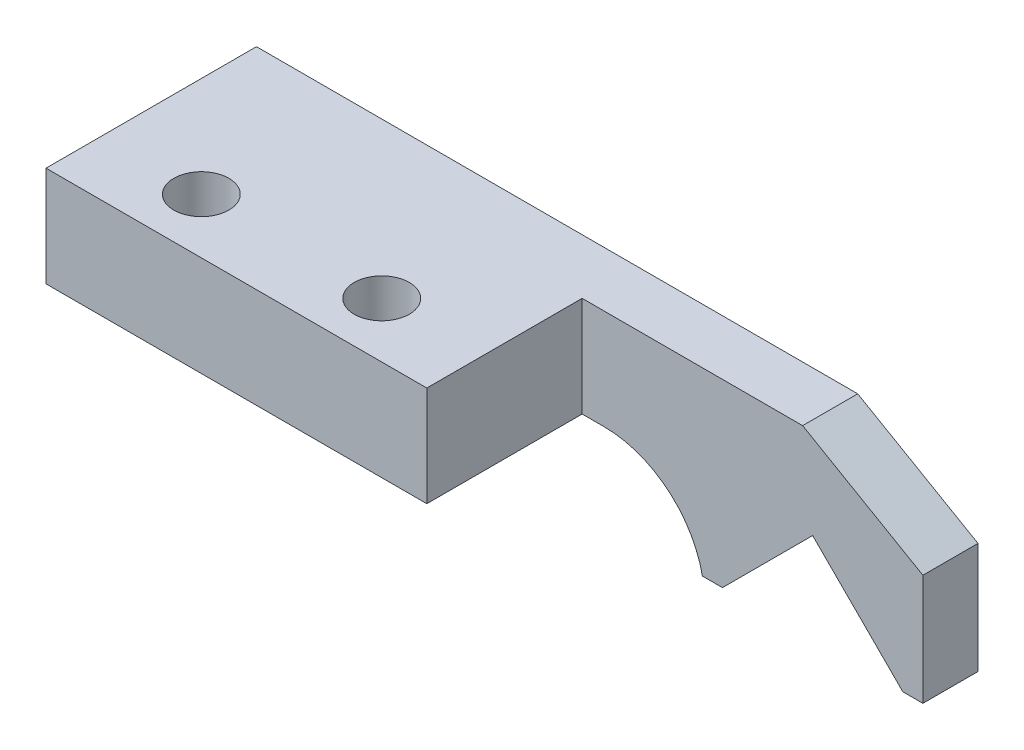
from build123d import *

# Parameters (mm, degrees)
BASE_EXTRUSION_DEPTH    = 21
ESQUISSE2_W             = 56.002380091
ESQUISSE2_H             = 20.539256902
ENL_V_MAT_EXTRU_1_DEPTH = 78.129760793
ESQUISSE3_R             = 5
ENL_V_MAT_EXTRU_2_DEPTH = 6
ESQUISSE4_R             = 2.75
ENL_V_MAT_EXTRU_3_DEPTH = 6


with BuildPart() as part:
    # Esquisse1 → Base-Extrusion (new body)
    with BuildSketch(Plane.XY):
        with BuildLine():
            Line((0, 0), (0, 10))
            Line((0, 10), (60, 10))
            Line((60, 10), (72, 3.07179677))
            Line((72, 3.07179677), (72, -8))
            Line((72, -8), (70, -8))
            Line((70, -8), (61, 1))
            Line((61, 1), (52, -8))
            Line((52, -8), (50, -8))
            ThreePointArc((50, -8), (46.526596349, -2.254033308), (40.202041029, 0))
            Line((40.202041029, 0), (0, 0))
        make_face()
    extrude(amount=BASE_EXTRUSION_DEPTH)

    # Esquisse2 → Enlèv. mat.-Extru.1 (cut, through all)
    with BuildSketch(Plane(origin=(0, 10, 0), x_dir=(-1, 0, 0), z_dir=(0, 1, 0))):
        with Locations((-66.001190046, 15.769628451)):
            Rectangle(ESQUISSE2_W, ESQUISSE2_H)
    extrude(amount=-ENL_V_MAT_EXTRU_1_DEPTH, mode=Mode.SUBTRACT)

    # Esquisse3 → Enlèv. mat.-Extru.2 (cut)
    with BuildSketch(Plane.XZ):
        with Locations(Location((28, 15.5, 0), (0, 0, 270))):
            Circle(ESQUISSE3_R)
        with Locations(Location((10, 15.5, 0), (0, 0, 270))):
            Circle(ESQUISSE3_R)
    extrude(amount=-ENL_V_MAT_EXTRU_2_DEPTH, mode=Mode.SUBTRACT)

    # Esquisse4 → Enlèv. mat.-Extru.3 (cut)
    with BuildSketch(Plane.XZ.offset(-6)):
        with Locations(Location((28, 15.5, 0), (0, 0, 270))):
            Circle(ESQUISSE4_R)
        with Locations(Location((10, 15.5, 0), (0, 0, 270))):
            Circle(ESQUISSE4_R)
    extrude(amount=-ENL_V_MAT_EXTRU_3_DEPTH, mode=Mode.SUBTRACT)


solid = part.part
